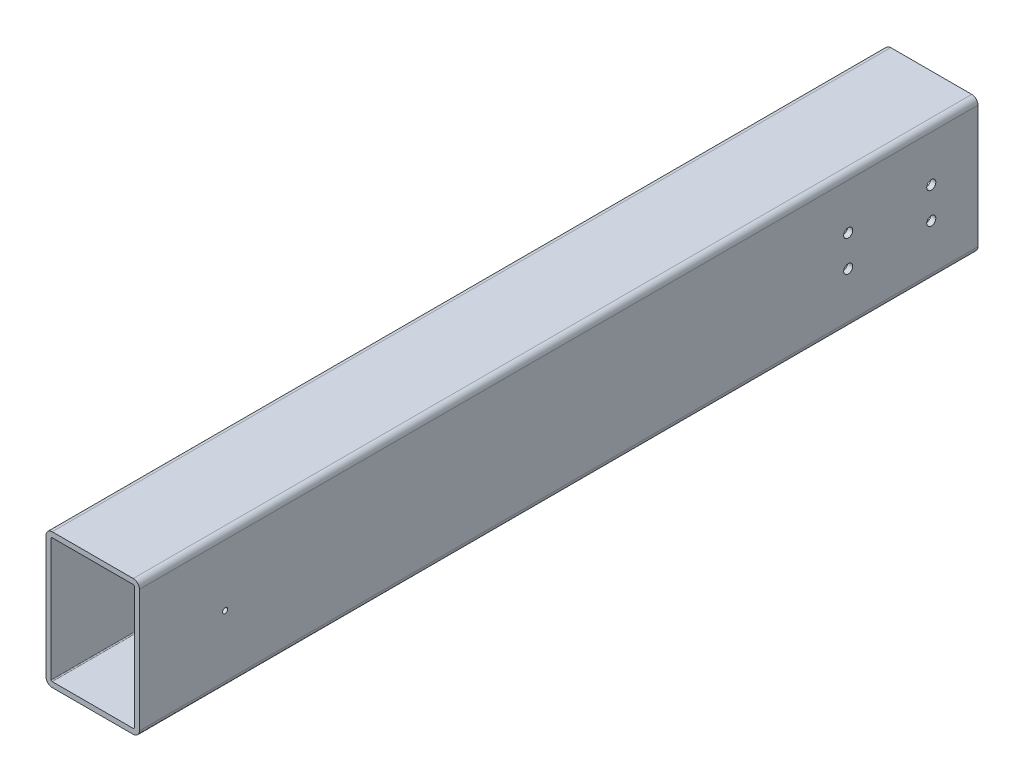
from build123d import *

# Parameters (mm, degrees)
TUBE_SQUARE_TS3X3X0_3125_1_DEPTH = 1615
M20X2_5_TAPPED_HOLE1_D           = 17.5
SKETCH19_R                       = 5
CUT_EXTRUDE1_DEPTH               = 838.470148722


with BuildPart() as part:
    # Sketch14 → Tube square TS3X3X0.3125(1) (new body)
    with BuildSketch(Plane(origin=(0, 0, -807.5), x_dir=(0, -1, 0), z_dir=(0, 0, 1))):
        with BuildLine():
            Line((-118, -90), (118, -90))
            ThreePointArc((118, -90), (126.485281374, -86.485281374), (130, -78))
            Line((130, -78), (130, 78))
            ThreePointArc((130, 78), (126.485281374, 86.485281374), (118, 90))
            Line((118, 90), (-118, 90))
            ThreePointArc((-118, 90), (-126.485281374, 86.485281374), (-130, 78))
            Line((-130, 78), (-130, -78))
            ThreePointArc((-130, -78), (-126.485281374, -86.485281374), (-118, -90))
        make_face()
        with BuildLine():
            Line((-118, -80), (118, -80))
            ThreePointArc((118, -80), (119.414213562, -79.414213562), (120, -78))
            Line((120, -78), (120, 78))
            ThreePointArc((120, 78), (119.414213562, 79.414213562), (118, 80))
            Line((118, 80), (-118, 80))
            ThreePointArc((-118, 80), (-119.414213562, 79.414213562), (-120, 78))
            Line((-120, 78), (-120, -78))
            ThreePointArc((-120, -78), (-119.414213562, -79.414213562), (-118, -80))
        make_face(mode=Mode.SUBTRACT)
    extrude(amount=TUBE_SQUARE_TS3X3X0_3125_1_DEPTH)

    # M20x2.5 Tapped Hole1 (through all)
    with Locations(Plane(origin=(90, 0, 0), x_dir=(0, 0, -1), z_dir=(1, 0, 0))):
        with Locations((717.5, 30), (557.5, 30), (557.5, -30), (717.5, -30)):
            Hole(M20X2_5_TAPPED_HOLE1_D / 2)

    # Sketch19 → Cut-Extrude1 (cut, through all)
    with BuildSketch(Plane(origin=(90, 0, 0), x_dir=(0, 0, -1), z_dir=(1, 0, 0))):
        with Locations(Location((-642.5, 0, 0), (0, 0, 90))):
            Circle(SKETCH19_R)
    extrude(amount=-CUT_EXTRUDE1_DEPTH, mode=Mode.SUBTRACT)


solid = part.part
